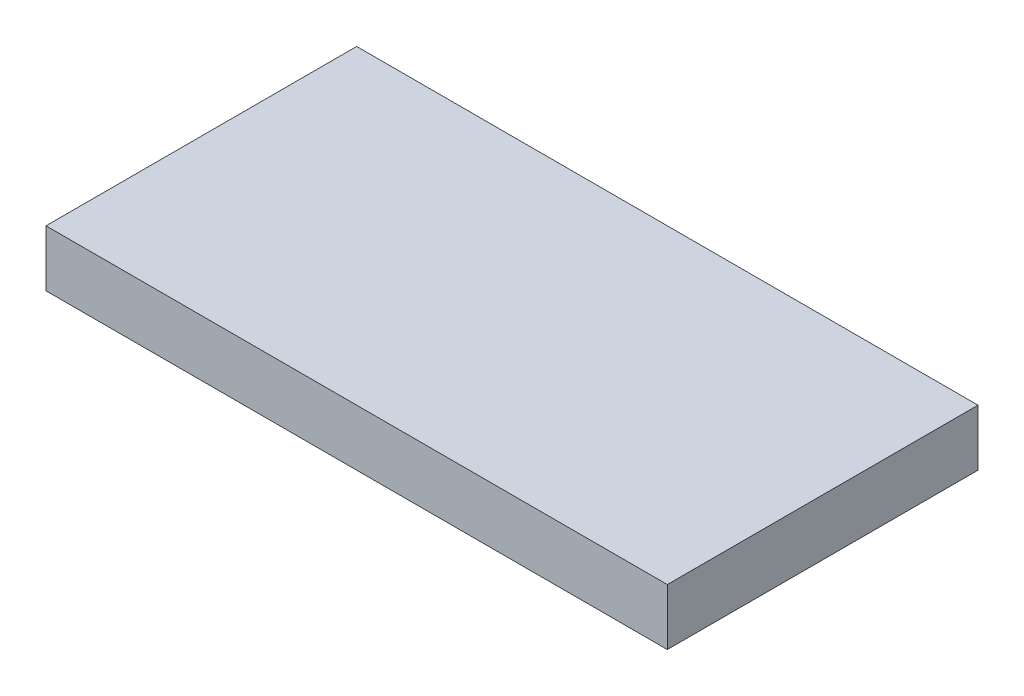
from build123d import *

# Parameters (mm, degrees)
SKETCH_1_W          = 160
SKETCH_1_H          = 80
EXTRUDE_1_DEPTH     = 14.5
SKETCH_3_R          = 2
CUT_EXTRUDE_1_DEPTH = 10


with BuildPart() as part:
    # 草图1 → 凸台-拉伸1 (new body)
    with BuildSketch(Plane(origin=(0, 0, 0), x_dir=(1, 0, 0), z_dir=(0, 1, 0))):
        with Locations((0, 40)):
            Rectangle(SKETCH_1_W, SKETCH_1_H)
    extrude(amount=EXTRUDE_1_DEPTH)

    # 草图3 → 切除-拉伸1 (cut)
    with BuildSketch(Plane.XZ):
        with Locations(Location((-30, -15, 0), (0, 0, 270))):
            Circle(SKETCH_3_R)
        with Locations(Location((30, -15, 0), (0, 0, 270))):
            Circle(SKETCH_3_R)
    extrude(amount=-CUT_EXTRUDE_1_DEPTH, mode=Mode.SUBTRACT)


solid = part.part
